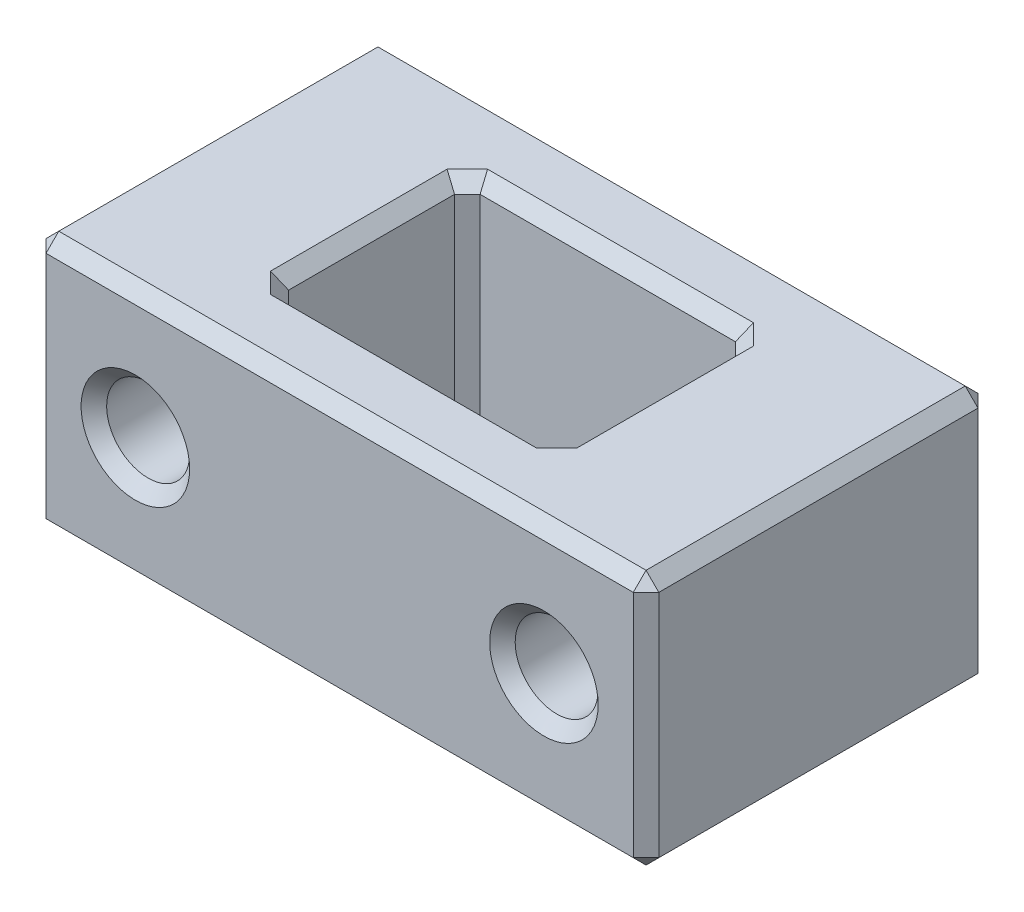
from build123d import *

# Parameters (mm, degrees)
SKETCH1_W           = 48
SKETCH1_H           = 27
BOSS_EXTRUDE1_DEPTH = 20
SKETCH2_W           = 22
SKETCH2_H           = 15
CUT_EXTRUDE1_DEPTH  = 108.682186993
SKETCH11_R          = 3.25
CUT_EXTRUDE2_DEPTH  = 110.846383385
CHAMFER2_SIZE       = 1
CHAMFER1_SIZE       = 1


with BuildPart() as part:
    # Sketch1 → Boss-Extrude1 (new body)
    with BuildSketch(Plane.XZ.offset(-9.508889291)):
        with Locations((-78.305686037, 13.5)):
            Rectangle(SKETCH1_W, SKETCH1_H)
    extrude(amount=-BOSS_EXTRUDE1_DEPTH)

    # Sketch2 → Cut-Extrude1 (cut, through all)
    with BuildSketch(Plane.XZ.offset(-9.508889291)):
        with Locations((-78.305686037, 13.5)):
            Rectangle(SKETCH2_W, SKETCH2_H)
    extrude(amount=-CUT_EXTRUDE1_DEPTH, mode=Mode.SUBTRACT)

    # Sketch11 → Cut-Extrude2 (cut, through all)
    with BuildSketch(Plane(origin=(0, 0, 0), x_dir=(-1, 0, 0), z_dir=(0, 0, -1))):
        with Locations((94.305686037, 19.508889291)):
            Circle(SKETCH11_R)
        with Locations((62.305686037, 19.508889291)):
            Circle(SKETCH11_R)
    extrude(amount=-CUT_EXTRUDE2_DEPTH, mode=Mode.SUBTRACT)

    # Chamfer2
    chamfer2_edges = [part.edges().sort_by_distance(p)[0] for p in [
        (-89.305686037, 19.508889291, 21),
        (-67.305686037, 19.508889291, 21),
        (-67.305686037, 19.508889291, 6),
        (-89.305686037, 19.508889291, 6),
    ]]
    chamfer(chamfer2_edges, length=CHAMFER2_SIZE)

    # Chamfer1
    chamfer1_edges = [part.edges().sort_by_distance(p)[0] for p in [
        (-54.305686037, 29.508889291, 13.5),
        (-78.305686037, 29.508889291, 27),
        (-91.055686037, 19.508889291, 27),
        (-91.055686037, 19.508889291, 0),
        (-59.055686037, 19.508889291, 27),
        (-59.055686037, 19.508889291, 0),
        (-78.305686037, 9.508889291, 6),
        (-78.305686037, 29.508889291, 6),
        (-89.305686037, 9.508889291, 13.5),
        (-102.305686037, 29.508889291, 13.5),
        (-89.305686037, 29.508889291, 13.5),
        (-67.305686037, 9.508889291, 13.5),
        (-67.305686037, 29.508889291, 13.5),
        (-78.305686037, 9.508889291, 21),
        (-78.305686037, 29.508889291, 21),
        (-78.305686037, 9.508889291, 27),
        (-88.805686037, 9.508889291, 6.5),
        (-88.805686037, 29.508889291, 6.5),
        (-67.805686037, 9.508889291, 6.5),
        (-67.805686037, 29.508889291, 6.5),
        (-67.805686037, 9.508889291, 20.5),
        (-67.805686037, 29.508889291, 20.5),
        (-88.805686037, 9.508889291, 20.5),
        (-54.305686037, 9.508889291, 13.5),
        (-88.805686037, 29.508889291, 20.5),
        (-78.305686037, 9.508889291, 0),
        (-102.305686037, 9.508889291, 13.5),
        (-78.305686037, 29.508889291, 0),
        (-102.305686037, 19.508889291, 27),
        (-54.305686037, 19.508889291, 27),
        (-54.305686037, 19.508889291, 0),
        (-102.305686037, 19.508889291, 0),
    ]]
    chamfer(chamfer1_edges, length=CHAMFER1_SIZE)


solid = part.part
